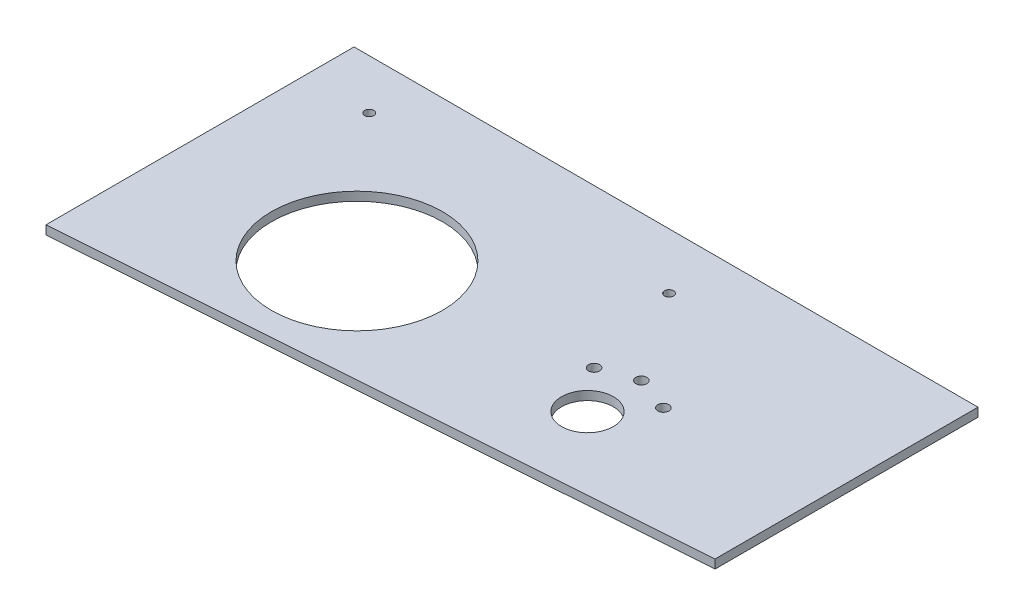
from build123d import *

# Parameters (mm, degrees)
BOSS_EXTRUDE2_DEPTH = 6.35
SKETCH3_R           = 3.3
SKETCH3_R_2         = 4
SKETCH3_R_3         = 61.9125
SKETCH3_R_4         = 18.75
CUT_EXTRUDE1_DEPTH  = 704.212713409


with BuildPart() as part:
    # Sketch2 → Boss-Extrude2 (new body)
    with BuildSketch(Plane(origin=(0, 0, 0), x_dir=(1, 0, 0), z_dir=(0, 1, 0))):
        Polygon((-672.391731841, 17.123030998), (-672.391731841, -205.808543922), (-220.848796652, -173.149778169), (-220.848796652, 17.123030998), align=None)
    extrude(amount=BOSS_EXTRUDE2_DEPTH)

    # Sketch3 → Cut-Extrude1 (cut, through all)
    with BuildSketch(Plane(origin=(0, 6.35, 0), x_dir=(1, 0, 0), z_dir=(0, 1, 0))):
        with Locations(Location((-403.939830292, -23.331851988, 0), (0, 0, 270))):
            Circle(SKETCH3_R)
        with Locations(Location((-625.491718045, -18.795833368, 0), (0, 0, 270))):
            Circle(SKETCH3_R)
        with Locations(Location((-359.363535158, -87.997654624, 0), (0, 0, 270))):
            Circle(SKETCH3_R_2)
        with Locations(Location((-384.432251936, -97.121921342, 0), (0, 0, 270))):
            Circle(SKETCH3_R_2)
        with Locations(Location((-334.294818381, -97.121921342, 0), (0, 0, 270))):
            Circle(SKETCH3_R_2)
        with Locations(Location((-537.163535159, -115.999131996, 0), (0, 0, 270))):
            Circle(SKETCH3_R_3)
        with Locations(Location((-359.363535158, -126.997654624, 0), (0, 0, 270))):
            Circle(SKETCH3_R_4)
    extrude(amount=-CUT_EXTRUDE1_DEPTH, mode=Mode.SUBTRACT)


solid = part.part
